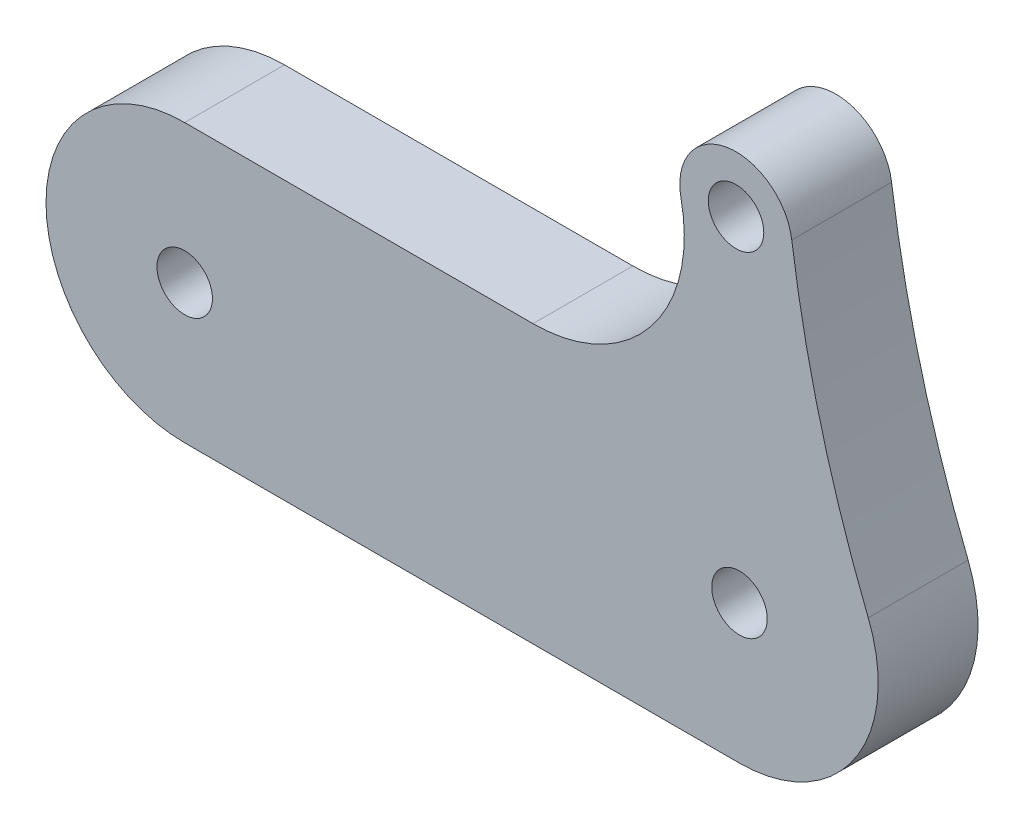
from build123d import *

# Parameters (mm, degrees)
SKETCH1_R           = 1
BOSS_EXTRUDE1_DEPTH = 3.6


with BuildPart() as part:
    # Sketch1 → Boss-Extrude1 (new body)
    with BuildSketch(Plane.XY):
        with BuildLine():
            Line((0, 5), (12.556863352, 5))
            ThreePointArc((12.556863352, 5), (16.792661174, 7.018934049), (17.891852228, 11.580716256))
            ThreePointArc((17.891852228, 11.580716256), (19.527471102, 13.99714741), (21.883567401, 12.27575296))
            ThreePointArc((21.883567401, 12.27575296), (22.943328128, 6.983448401), (24.641136419, 1.860067939))
            ThreePointArc((24.641136419, 1.860067939), (24.141276355, -2.801754834), (20, -5))
            Line((20, -5), (0, -5))
            ThreePointArc((0, -5), (-5, 0), (0, 5))
        make_face()
        Circle(SKETCH1_R, mode=Mode.SUBTRACT)
        with Locations((20, 0)):
            Circle(SKETCH1_R, mode=Mode.SUBTRACT)
        with Locations((19.875214038, 12)):
            Circle(SKETCH1_R, mode=Mode.SUBTRACT)
    extrude(amount=BOSS_EXTRUDE1_DEPTH)


solid = part.part
